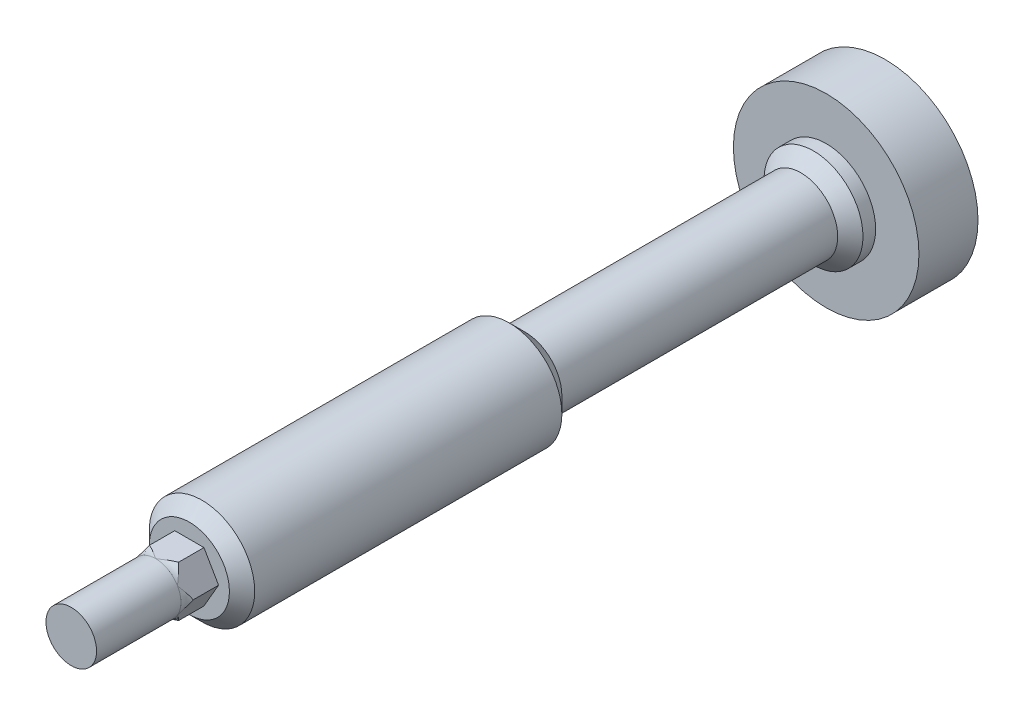
from build123d import *

# Parameters (mm, degrees)
BOSS_EXTRUDE1_DEPTH = 14
SKETCH3_OUTSIDE_W   = 44.278
SKETCH3_OUTSIDE_H   = 44.278
SKETCH3_OUTSIDE_R   = 3
CUT_EXTRUDE1_DEPTH  = 10


with BuildPart() as part:
    # Sketch1 → Revolve1 (revolve)
    with BuildSketch(Plane(origin=(0, 0, 0), x_dir=(1, 0, 0), z_dir=(0, 1, 0))):
        Polygon((0, 0), (0, 82.5), (11, 82.5), (11, 75.5), (5.865, 75.5), (5.865, 74), (4.365, 72.5), (4.365, 39.8), (6.25, 37.915), (6.25, 1.5), (4.75, 0), align=None)
    revolve(axis=Axis((0, 0, 0), (0, 0, -1)))

    # Sketch2 → Boss-Extrude1 (add)
    with BuildSketch(Plane.XY):
        Polygon((3.464101615, 0), (1.732050808, 3), (-1.732050808, 3), (-3.464101615, 0), (-1.732050808, -3), (1.732050808, -3), align=None)
    extrude(amount=BOSS_EXTRUDE1_DEPTH)

    # Sketch3 outside → Cut-Extrude1 (cut)
    with BuildSketch(Plane.XY.offset(14)):
        Rectangle(SKETCH3_OUTSIDE_W, SKETCH3_OUTSIDE_H)
        Circle(SKETCH3_OUTSIDE_R, mode=Mode.SUBTRACT)
    extrude(amount=-CUT_EXTRUDE1_DEPTH, mode=Mode.SUBTRACT)

    # Sketch4 → Cut-Revolve1 (revolve, cut)
    with BuildSketch(Plane(origin=(0, 0, 0), x_dir=(1, 0, 0), z_dir=(0, 1, 0))):
        with BuildLine():
            Line((3.464101615, -3), (3.464101615, -4))
            Line((3.464101615, -4), (3, -4))
            ThreePointArc((3, -4), (3.121679054, -3.448776291), (3.464101615, -3))
        make_face()
    revolve(axis=Axis((0, 0, 0), (0, 0, 1)), mode=Mode.SUBTRACT)


solid = part.part
